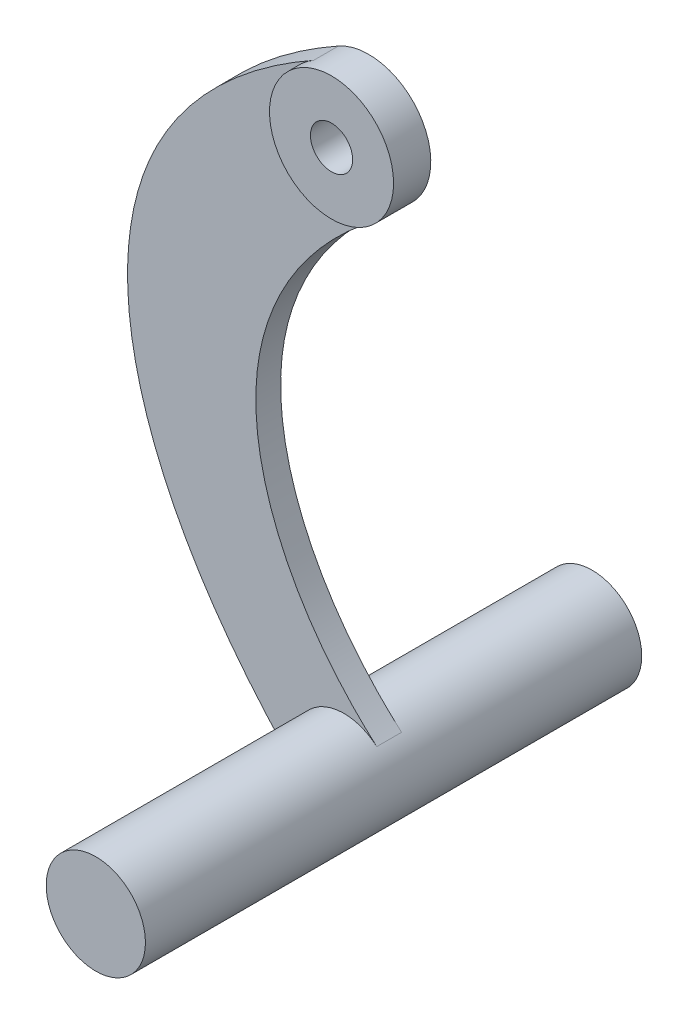
from build123d import *
from build123d.topology import SkipClean

# Parameters (mm, degrees)
SKETCH1_R                = 12.5
SKETCH1_R_2              = 4.25
BOSS_EXTRUDE1_DEPTH      = 2.5
BOSS_EXTRUDE2_START      = 5
BOSS_EXTRUDE2_DEPTH      = 5
BOSS_EXTRUDE3_DEPTH      = 50
BOSS_EXTRUDE3_DEPTH_BACK = 50
SKETCH3_R                = 10
CUT_EXTRUDE1_START       = -40
SKETCH4_R                = 4.25
CUT_EXTRUDE1_DEPTH       = 40


with BuildPart() as part:
    # Sketch1 → Boss-Extrude1 (new body)
    with BuildSketch(Plane.XY):
        Circle(SKETCH1_R)
        Circle(SKETCH1_R_2, mode=Mode.SUBTRACT)
    extrude(amount=BOSS_EXTRUDE1_DEPTH)

    # Sketch2 → Boss-Extrude2 (add)
    with SkipClean():  # the faces are left unmerged after this step: merging them gives an invalid solid
        with BuildSketch(Plane(origin=(0, 0, 0), x_dir=(-1, 0, 0), z_dir=(0, 0, -1)).offset(BOSS_EXTRUDE2_START)):
            with BuildLine():
                ThreePointArc((-6.611094261, -102.497105047), (-7.323414251, -116.809376161), (7.00278738, -117.138695182))
                add(Edge.make_bspline(
                    [(6.106396375, 10.906966733), (20.621715475, 2.78039093), (57.030134585, -32.014511607), (40.003016754, -84.766730291), (7.00278738, -117.138695182)],
                    knots=[0, 0, 0, 0, 0.30202419, 1, 1, 1, 1], degree=3))
                ThreePointArc((6.106396375, 10.906966733), (-10.50822507, 6.769579446), (-7.406819033, -10.069212075))
                add(Edge.make_bspline(
                    [(-7.406819033, -10.069212075), (7.979907505, -21.387545439), (26.855730435, -52.646283336), (9.439793984, -88.354039493), (-6.611094261, -102.497105047)],
                    knots=[0, 0, 0, 0, 0.455821989, 1, 1, 1, 1], degree=3))
            make_face()
        extrude(amount=-BOSS_EXTRUDE2_DEPTH)

    # Sketch3 → Boss-Extrude3 (add, two sides: drawn at the far end of the back side and taken through both)
    with SkipClean():  # the faces are left unmerged after this step: merging them gives an invalid solid
        with BuildSketch(Plane.XY.offset(-BOSS_EXTRUDE3_DEPTH_BACK)):
            with Locations((0, -110)):
                Circle(SKETCH3_R)
        extrude(amount=BOSS_EXTRUDE3_DEPTH + BOSS_EXTRUDE3_DEPTH_BACK)

    # Sketch4 → Cut-Extrude1 (cut)
    with SkipClean():  # the faces are left unmerged after this step: merging them gives an invalid solid
        with BuildSketch(Plane.XY.offset(CUT_EXTRUDE1_START)):
            Circle(SKETCH4_R)
        extrude(amount=CUT_EXTRUDE1_DEPTH, mode=Mode.SUBTRACT)


solid = part.part
